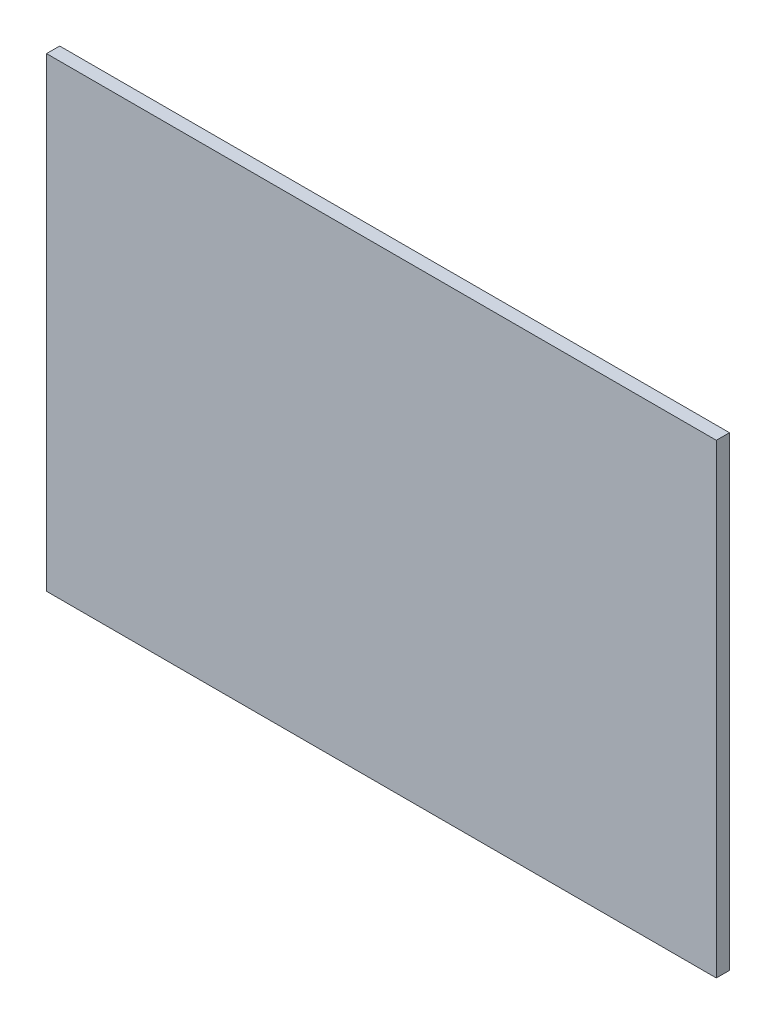
from build123d import *

# Parameters (mm, degrees)
SKETCH1_W           = 155.305
SKETCH1_H           = 112.395
BOSS_EXTRUDE1_DEPTH = 3.175
SKETCH2_W           = 3.175
SKETCH2_H           = 112.395
BOSS_EXTRUDE2_DEPTH = 6.35


with BuildPart() as part:
    # Sketch1 → Boss-Extrude1 (new body)
    with BuildSketch(Plane.XY):
        with Locations((-123.005289853, 114.695513388)):
            Rectangle(SKETCH1_W, SKETCH1_H)
    extrude(amount=BOSS_EXTRUDE1_DEPTH)

    # Sketch2 → Boss-Extrude2 (add)
    with BuildSketch(Plane.ZY.offset(200.657789853)):
        with Locations((1.5875, 114.695513388)):
            Rectangle(SKETCH2_W, SKETCH2_H)
    extrude(amount=BOSS_EXTRUDE2_DEPTH)


solid = part.part
